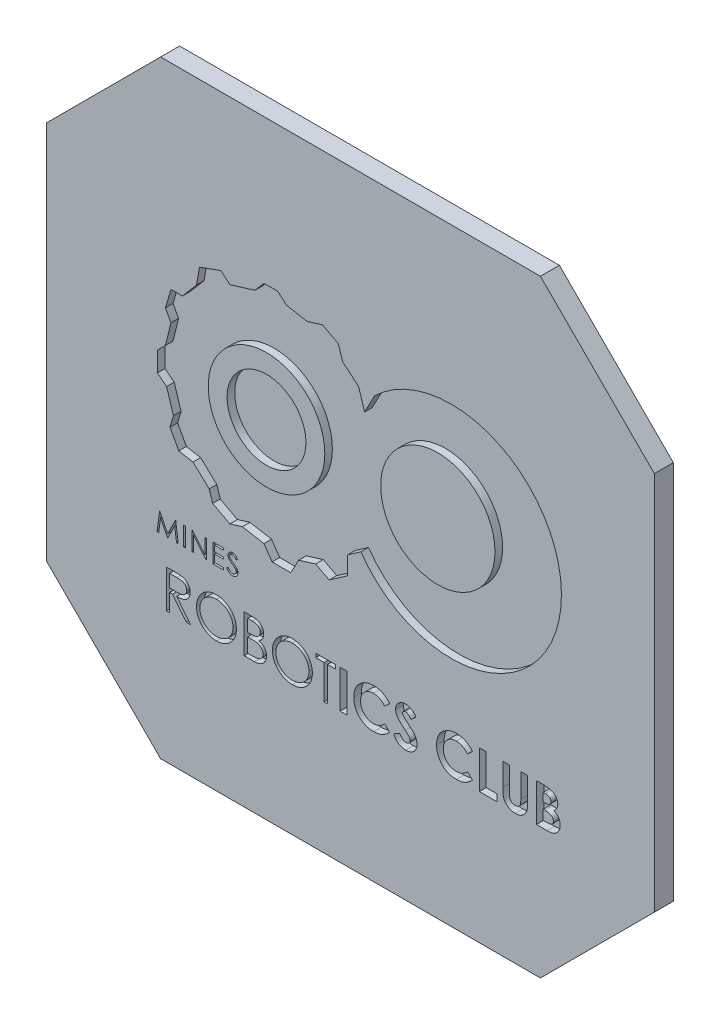
from build123d import *

# Parameters (mm, degrees)
BOSS_EXTRUDE1_DEPTH = 5
SKETCH4_W           = 1.794871795
SKETCH4_H           = 10
SKETCH4_W_2         = 0.448717949
SKETCH4_H_2         = 5
CUT_EXTRUDE1_DEPTH  = 2
SKETCH5_R           = 15.347621391
SKETCH5_R_2         = 10.37860483
SKETCH5_R_3         = 15.052591917
BOSS_EXTRUDE2_DEPTH = 2


with BuildPart() as part:
    # Sketch1 → Boss-Extrude1 (new body)
    with BuildSketch(Plane.XY):
        Polygon((-80, -50), (-50, -80), (50, -80), (80, -50), (80, 50), (50, 80), (-50, 80), (-80, 50), align=None)
    extrude(amount=BOSS_EXTRUDE1_DEPTH)

    # Sketch4 → Cut-Extrude1 (cut)
    # profile 1 of 18: a face of its own
    with BuildSketch(Plane(origin=(0, 0, 5), x_dir=(-1, 0, 0), z_dir=(0, 0, -1))):
        with BuildLine():
            Line((36.304513393, -14.940868697), (31.757487653, -17.348117618))
            Line((31.757487653, -17.348117618), (28.458906023, -16.333169425))
            Line((28.458906023, -16.333169425), (22.797172224, -17.348117618))
            Line((22.797172224, -17.348117618), (20.637668285, -20.450976732))
            Line((20.637668285, -20.450976732), (15.709161512, -20.450976732))
            Line((15.709161512, -20.450976732), (13.651864036, -16.564970389))
            Line((13.651864036, -16.564970389), (9.163595361, -15.183964643))
            Line((9.163595361, -15.183964643), (5.620639841, -17.059646977))
            Line((5.620639841, -17.059646977), (0.741236761, -13.663717678))
            Line((0.741236761, -13.663717678), (0.741236761, -8.881078621))
            Line((0.741236761, -8.881078621), (-2.736472889, -6.460689098))
            ThreePointArc((-2.736472889, -6.460689098), (-55.404131195, 7.310152687), (-6.357286931, 30.930596855))
            Line((-6.357286931, 30.930596855), (-3.693047923, 25.898145394))
            Line((-3.693047923, 25.898145394), (-2.16058621, 30.87864596))
            Line((-2.16058621, 30.87864596), (2.108921504, 34.516755721))
            Line((2.108921504, 34.516755721), (3.180938301, 38.00081031))
            Line((3.180938301, 38.00081031), (7.392117601, 40.230258174))
            Line((7.392117601, 40.230258174), (11.407729698, 38.994685221))
            Line((11.407729698, 38.994685221), (16.778456586, 39.95746619))
            Line((16.778456586, 39.95746619), (19.162521626, 41.988962764))
            Line((19.162521626, 41.988962764), (22.797172224, 41.988962764))
            Line((22.797172224, 41.988962764), (25.146350495, 39.232082018))
            Line((25.146350495, 39.232082018), (31.757487653, 37.197885969))
            Line((31.757487653, 37.197885969), (34.144720665, 39.232082018))
            Line((34.144720665, 39.232082018), (39.760941009, 37.197885969))
            Line((39.760941009, 37.197885969), (40.567664697, 32.69770084))
            Line((40.567664697, 32.69770084), (44.239686443, 28.388395677))
            Line((44.239686443, 28.388395677), (47.270869589, 28.388395677))
            Line((47.270869589, 28.388395677), (48.727775159, 23.441377989))
            Line((48.727775159, 23.441377989), (47.270869589, 20.768136801))
            Line((47.270869589, 20.768136801), (48.727775159, 14.833654176))
            Line((48.727775159, 14.833654176), (50.838106296, 12.73673525))
            Line((50.838106296, 12.73673525), (50.838106296, 7.537525309))
            Line((50.838106296, 7.537525309), (48.425213285, 5.6416808))
            Line((48.425213285, 5.6416808), (46.615543527, -0.10330256))
            Line((46.615543527, -0.10330256), (47.520378406, -3.175728284))
            Line((47.520378406, -3.175728284), (45.207332751, -7.41988044))
            Line((45.207332751, -7.41988044), (41.47378342, -8.08882943))
            Line((41.47378342, -8.08882943), (37.193770816, -12.081592865))
            Line((37.193770816, -12.081592865), (36.304513393, -14.940868697))
        make_face()
    # profile 2 of 18: a face of its own
    with BuildSketch(Plane(origin=(0, 0, 5), x_dir=(-1, 0, 0), z_dir=(0, 0, -1))):
        with BuildLine():
            Line((48.501926314, -35.520202089), (46.50072439, -35.520202089))
            add(Edge.make_bspline(
                [(46.50072439, -35.520202089), (46.367178309, -35.52064662), (46.110755039, -35.52150017), (45.743402838, -35.526259492), (45.409611133, -35.539900509), (45.109554449, -35.551639319), (44.843238292, -35.573044865), (44.609846032, -35.593503857), (44.410452611, -35.620285745), (44.289750179, -35.645158382), (44.23509939, -35.656420037)],
                knots=[0, 0, 0, 0, 1.410062039, 2.707475311, 3.878576406, 4.937260626, 5.877586885, 6.699081471, 7.410979367, 8, 8, 8, 8], degree=3))
            add(Edge.make_bspline(
                [(44.23509939, -35.656420037), (44.161937607, -35.67449651), (44.01717478, -35.710263835), (43.80874602, -35.785862694), (43.610133666, -35.873347336), (43.422162739, -35.976100823), (43.245774764, -36.094885907), (43.079151019, -36.227651971), (42.92153541, -36.373672559), (42.779302181, -36.536629249), (42.645190604, -36.707590706), (42.532080243, -36.892458582), (42.434576015, -37.085777232), (42.356945967, -37.289512712), (42.294437471, -37.501689203), (42.250362501, -37.724228622), (42.223930537, -37.956117122), (42.221239521, -38.114282576), (42.219875031, -38.194480935)],
                knots=[0, 0, 0, 0, 1.027469482, 2.033020251, 3.019912614, 3.986113645, 4.951240523, 5.91722682, 6.890402269, 7.87763091, 8.8651537, 9.85103654, 10.82876324, 11.815024772, 12.821070561, 13.842952187, 14.906261191, 16, 16, 16, 16], degree=3))
            add(Edge.make_bspline(
                [(42.219875031, -38.194480935), (42.224072169, -38.327724091), (42.232261871, -38.587715999), (42.30861931, -38.965032803), (42.433695081, -39.317002274), (42.606047335, -39.643181239), (42.825531552, -39.937211654), (43.089316669, -40.195470098), (43.397549845, -40.411584134), (43.684490747, -40.56144929), (43.937959889, -40.657429029), (44.146626497, -40.724961483), (44.374246433, -40.777138527), (44.618638818, -40.82388176), (44.88082069, -40.859172316), (45.16016366, -40.885019729), (45.456866951, -40.901174154), (45.660692863, -40.903579882), (45.765548108, -40.904817473)],
                knots=[0, 0, 0, 0, 1.260483769, 2.459530307, 3.627416485, 4.787058657, 5.939039949, 7.08810263, 8.267026773, 9.491475466, 10.141966685, 10.831826277, 11.566392101, 12.351337768, 13.187381173, 14.07005841, 15.007169909, 16, 16, 16, 16], degree=3))
            Line((45.765548108, -40.904817473), (42.091669903, -45.520202089))
            Line((42.091669903, -45.520202089), (43.201445544, -45.520202089))
            Line((43.201445544, -45.520202089), (46.875323749, -40.904817473))
            Line((46.875323749, -40.904817473), (47.604490416, -40.904817473))
            Line((47.604490416, -40.904817473), (47.604490416, -45.520202089))
            Line((47.604490416, -45.520202089), (48.501926314, -45.520202089))
            Line((48.501926314, -45.520202089), (48.501926314, -35.520202089))
        make_face()
        with BuildLine():
            Line((47.604490416, -36.545843114), (47.604490416, -39.879176448))
            Line((47.604490416, -39.879176448), (45.773560929, -39.893198884))
            add(Edge.make_bspline(
                [(45.773560929, -39.893198884), (45.688075103, -39.893236703), (45.522379226, -39.893310007), (45.282663041, -39.881899217), (45.059462722, -39.868918308), (44.853632001, -39.849063035), (44.665078929, -39.823474259), (44.493897748, -39.791465732), (44.339809028, -39.754174125), (44.160098919, -39.696455194), (43.959423115, -39.605009427), (43.741333229, -39.471965146), (43.555612264, -39.304624805), (43.398704086, -39.113272074), (43.272619997, -38.902882791), (43.183728413, -38.675978879), (43.127321435, -38.438288599), (43.120668448, -38.274922577), (43.117310929, -38.19247773)],
                knots=[0, 0, 0, 0, 1.146690395, 2.22261258, 3.21895312, 4.145990853, 4.996080663, 5.770904154, 6.481378293, 7.121626537, 8.300444488, 9.431385265, 10.535395872, 11.636531494, 12.74115979, 13.810798291, 14.895190096, 16, 16, 16, 16], degree=3))
            add(Edge.make_bspline(
                [(43.117310929, -38.19247773), (43.120745561, -38.112058948), (43.127551747, -37.952698266), (43.183119657, -37.719395665), (43.277089318, -37.499204379), (43.403724284, -37.293020136), (43.558007584, -37.105860891), (43.73891562, -36.945726168), (43.941501892, -36.81358484), (44.130848173, -36.729143753), (44.30008878, -36.677372744), (44.447030666, -36.640940847), (44.613063459, -36.611670936), (44.798993341, -36.588219333), (45.004026572, -36.56806235), (45.229199861, -36.554485839), (45.473019233, -36.546446228), (45.642010465, -36.546048831), (45.729490416, -36.545843114)],
                knots=[0, 0, 0, 0, 1.101028733, 2.181837193, 3.264309656, 4.369019818, 5.486613113, 6.575447106, 7.666700264, 8.788928104, 9.402425223, 10.0903467, 10.862060571, 11.710948788, 12.657782767, 13.684531032, 14.801375019, 16, 16, 16, 16], degree=3))
            Line((45.729490416, -36.545843114), (47.604490416, -36.545843114))
        make_face(mode=Mode.SUBTRACT)
    # profile 3 of 18: a face of its own
    with BuildSketch(Plane(origin=(0, 0, 5), x_dir=(-1, 0, 0), z_dir=(0, 0, -1))):
        with BuildLine():
            add(Edge.make_bspline(
                [(35.360900673, -35.263791832), (35.175734656, -35.268481773), (34.812053321, -35.277693205), (34.277553614, -35.348204929), (33.767281913, -35.470191758), (33.277081516, -35.632657422), (32.812815869, -35.849384237), (32.370990462, -36.111341804), (31.952656537, -36.421274543), (31.563452589, -36.77678662), (31.207289874, -37.163596488), (30.893501628, -37.576390517), (30.630523646, -38.012672809), (30.414564254, -38.471132325), (30.245139655, -38.950732234), (30.128228101, -39.454029385), (30.053547672, -39.977762785), (30.04481688, -40.334982398), (30.040387852, -40.516195679)],
                knots=[0, 0, 0, 0, 1.065120563, 2.091984664, 3.0946048, 4.079830382, 5.057816894, 6.036188127, 7.030412546, 8.04752943, 9.064399622, 10.05169764, 11.02544977, 11.989514704, 12.962713494, 13.945757189, 14.957906945, 16, 16, 16, 16], degree=3))
            add(Edge.make_bspline(
                [(30.040387852, -40.516195679), (30.044816231, -40.696074097), (30.053545078, -41.050635298), (30.128313014, -41.571045138), (30.245573014, -42.071304271), (30.412990917, -42.550577565), (30.627920856, -43.009370604), (30.892649916, -43.446476187), (31.204481947, -43.862037611), (31.559358664, -44.251502368), (31.946218784, -44.608637999), (32.361162403, -44.919834787), (32.794857603, -45.187618), (33.252885341, -45.40128564), (33.72917116, -45.572062555), (34.227977798, -45.688498641), (34.746967952, -45.763604479), (35.100885106, -45.77222881), (35.280772467, -45.776612345)],
                knots=[0, 0, 0, 0, 1.043624062, 2.057103931, 3.04512605, 4.022047818, 4.998200453, 5.980619268, 6.982898556, 8.009068085, 9.034988726, 10.034168286, 11.015286542, 11.987931943, 12.962482838, 13.94673481, 14.956375938, 16, 16, 16, 16], degree=3))
            add(Edge.make_bspline(
                [(35.280772467, -45.776612345), (35.461984807, -45.772185526), (35.819202567, -45.763459086), (36.343594097, -45.688655072), (36.847244794, -45.571679918), (37.328714368, -45.404510101), (37.78827131, -45.18846087), (38.226814404, -44.925019787), (38.642583396, -44.612427955), (39.032131243, -44.257666313), (39.388557523, -43.871461879), (39.699298597, -43.457649722), (39.96279892, -43.024348417), (40.178122728, -42.570355491), (40.348592611, -42.097865655), (40.464892092, -41.603727147), (40.540137669, -41.090757131), (40.548808659, -40.741491707), (40.553208365, -40.564272602)],
                knots=[0, 0, 0, 0, 1.053102029, 2.075944431, 3.073151272, 4.055350789, 5.033113405, 6.020478099, 7.024410459, 8.052272461, 9.079885166, 10.07527673, 11.055994387, 12.023226415, 12.992069828, 13.970394897, 14.97016774, 16, 16, 16, 16], degree=3))
            add(Edge.make_bspline(
                [(40.553208365, -40.564272602), (40.551680835, -40.445322118), (40.548645045, -40.208921765), (40.512097352, -39.857874336), (40.45906392, -39.512472457), (40.383058456, -39.17369832), (40.283653693, -38.842381221), (40.166362186, -38.516236184), (40.023105485, -38.198568402), (39.861160777, -37.887872997), (39.680412754, -37.588993266), (39.480767755, -37.306480172), (39.269238131, -37.037963038), (39.037342721, -36.79040017), (38.792724306, -36.556589723), (38.531414654, -36.340124817), (38.255008242, -36.139053529), (37.962315728, -35.957852554), (37.660549228, -35.793969312), (37.34947272, -35.653335453), (37.033311088, -35.53263242), (36.710583522, -35.43480149), (36.38214703, -35.357567102), (36.047284789, -35.304974663), (35.706263571, -35.268333755), (35.476516945, -35.26531232), (35.360900673, -35.263791832)],
                knots=[0, 0, 0, 0, 1.037015668, 2.060948919, 3.074880161, 4.083647147, 5.086022904, 6.090072063, 7.104153813, 8.122640571, 9.144368836, 10.147691507, 11.138137339, 12.123020368, 13.103399296, 14.087645067, 15.080126199, 16.082011238, 17.087798457, 18.072939717, 19.057185487, 20.037253025, 21.01195951, 21.997135196, 22.992090687, 24, 24, 24, 24], degree=3))
        make_face()
        with BuildLine():
            add(Edge.make_bspline(
                [(35.31683016, -36.289432858), (35.411729113, -36.290589687), (35.600619778, -36.292892287), (35.881432739, -36.323222902), (36.15855255, -36.366451157), (36.432036442, -36.428112645), (36.700740126, -36.512124224), (36.967168243, -36.608812533), (37.228891254, -36.726587078), (37.485045134, -36.859651947), (37.73337392, -37.006934578), (37.967695924, -37.169711055), (38.188617764, -37.344164067), (38.395598526, -37.530700746), (38.588030447, -37.730271036), (38.769701022, -37.939849425), (38.933328398, -38.165426257), (39.083287189, -38.400884562), (39.217481019, -38.645917651), (39.336810603, -38.897945829), (39.434422057, -39.159024934), (39.514028847, -39.426322528), (39.580028306, -39.699415269), (39.621839518, -39.980374838), (39.652503402, -40.267789443), (39.654674389, -40.462023312), (39.655772467, -40.560266191)],
                knots=[0, 0, 0, 0, 1.008559885, 2.007477868, 2.99961109, 3.989939068, 4.984837346, 5.991145699, 7.001802488, 8.033829008, 9.059044045, 10.069351652, 11.065060232, 12.050310815, 13.029377138, 14.011219647, 14.996725999, 15.989392538, 16.977580475, 17.965360261, 18.951710183, 19.937753436, 20.929683414, 21.935841486, 22.955955122, 24, 24, 24, 24], degree=3))
            add(Edge.make_bspline(
                [(39.655772467, -40.560266191), (39.652130005, -40.704729679), (39.644964154, -40.988934052), (39.582228239, -41.405414463), (39.485594026, -41.805666709), (39.343144408, -42.187500736), (39.164999795, -42.554198687), (38.944922965, -42.902507557), (38.684182721, -43.232521484), (38.388001216, -43.541936538), (38.064222054, -43.824353122), (37.720414255, -44.072248575), (37.36026109, -44.281992146), (36.982823368, -44.452863781), (36.590116114, -44.588263032), (36.179608825, -44.681059121), (35.754036084, -44.742131851), (35.463948497, -44.747996868), (35.31683016, -44.75097132)],
                knots=[0, 0, 0, 0, 1.032063989, 2.030389145, 3.003944642, 3.970395727, 4.937377036, 5.913328081, 6.909231446, 7.93887556, 8.970685674, 9.976071282, 10.964166581, 11.944589148, 12.933237628, 13.927779006, 14.949070134, 16, 16, 16, 16], degree=3))
            add(Edge.make_bspline(
                [(35.31683016, -44.75097132), (35.217945869, -44.749612736), (35.021828623, -44.746918256), (34.73012713, -44.719779179), (34.443680811, -44.676259552), (34.16289144, -44.613600536), (33.888077693, -44.535179946), (33.618092541, -44.442015009), (33.355811712, -44.325782999), (33.097926461, -44.19736028), (32.851080056, -44.05095983), (32.615435678, -43.893707974), (32.396932879, -43.719511915), (32.19010696, -43.535746736), (31.996884992, -43.338707171), (31.818573608, -43.128649394), (31.655773231, -42.904247516), (31.505871383, -42.669146357), (31.372147775, -42.423442778), (31.255636064, -42.170500841), (31.156790018, -41.910943385), (31.07699429, -41.644396038), (31.0144644, -41.371365042), (30.971378914, -41.091484818), (30.941240518, -40.805315268), (30.938968869, -40.611761394), (30.937823749, -40.514192473)],
                knots=[0, 0, 0, 0, 1.047197238, 2.076906641, 3.100256066, 4.114471768, 5.12198147, 6.126382909, 7.136867548, 8.15857795, 9.17633901, 10.174870724, 11.156907918, 12.133735059, 13.104061851, 14.077631395, 15.04955518, 16.038496417, 17.029181396, 18.010275684, 18.986308667, 19.968651475, 20.955262928, 21.950658345, 22.966943676, 24, 24, 24, 24], degree=3))
            add(Edge.make_bspline(
                [(30.937823749, -40.514192473), (30.938969787, -40.417291033), (30.941243162, -40.225069175), (30.971364518, -39.940895408), (31.014509919, -39.66302909), (31.076689085, -39.392561081), (31.156832382, -39.129422438), (31.255653325, -38.873860302), (31.372182753, -38.624922602), (31.505920537, -38.38322461), (31.656251461, -38.151296787), (31.820520727, -37.929575609), (32.001564579, -37.722224919), (32.194210365, -37.524125793), (32.403270037, -37.339503252), (32.627796591, -37.16829605), (32.865064242, -37.006372409), (33.116284915, -36.860299375), (33.375553354, -36.725401567), (33.641593234, -36.609827273), (33.911390661, -36.511621217), (34.184259554, -36.42785846), (34.462496635, -36.36669266), (34.74422186, -36.323183946), (35.029045456, -36.292902843), (35.220597512, -36.29059319), (35.31683016, -36.289432858)],
                knots=[0, 0, 0, 0, 1.02996197, 2.043119294, 3.035359645, 4.018872909, 4.991431989, 5.957985074, 6.929999688, 7.912076566, 8.892894881, 9.867085534, 10.843653904, 11.817741046, 12.803660682, 13.806313499, 14.818574707, 15.856120519, 16.894564902, 17.924820532, 18.937903209, 19.946497019, 20.957711757, 21.963978472, 22.977135795, 24, 24, 24, 24], degree=3))
        make_face(mode=Mode.SUBTRACT)
    # profile 4 of 18: a face of its own
    with BuildSketch(Plane(origin=(0, 0, 5), x_dir=(-1, 0, 0), z_dir=(0, 0, -1))):
        with BuildLine():
            Line((27.989105801, -35.520202089), (26.037984006, -35.520202089))
            add(Edge.make_bspline(
                [(26.037984006, -35.520202089), (25.942474068, -35.520704233), (25.757352039, -35.521677513), (25.488153633, -35.536772173), (25.236014174, -35.557354087), (25.000860539, -35.590011495), (24.782801389, -35.629416572), (24.581179569, -35.677136047), (24.396636219, -35.734354943), (24.176314115, -35.825344318), (23.925112227, -35.96055337), (23.653116819, -36.160349271), (23.420533278, -36.404727737), (23.220000943, -36.680392467), (23.060569173, -36.983637529), (22.945228324, -37.307235211), (22.872205823, -37.647011617), (22.864696011, -37.880277839), (22.860900673, -37.998166832)],
                knots=[0, 0, 0, 0, 1.001505555, 1.941167018, 2.826882275, 3.653841531, 4.429895133, 5.150066043, 5.825578002, 6.45369114, 7.647487171, 8.808567382, 9.977351308, 11.170798116, 12.373658725, 13.556498008, 14.765093433, 16, 16, 16, 16], degree=3))
            add(Edge.make_bspline(
                [(22.860900673, -37.998166832), (22.864024154, -38.108602706), (22.870162089, -38.325619611), (22.928855687, -38.643031352), (23.020743311, -38.945177692), (23.148472595, -39.230955936), (23.314478298, -39.493909116), (23.511216351, -39.736158448), (23.748578644, -39.947447182), (23.926416473, -40.065569761), (24.016750031, -40.125570679)],
                knots=[0, 0, 0, 0, 1.044552857, 2.05264487, 3.044412934, 4.028983338, 5.005914585, 5.980388656, 6.974128949, 8, 8, 8, 8], degree=3))
            add(Edge.make_bspline(
                [(24.016750031, -40.125570679), (23.90314881, -40.169184961), (23.685801532, -40.252629888), (23.386698639, -40.400159785), (23.128999082, -40.560622958), (22.910721522, -40.735856815), (22.724042508, -40.924739132), (22.561034103, -41.130039458), (22.421944463, -41.354435909), (22.302764681, -41.595588867), (22.209768235, -41.85103592), (22.140122794, -42.118380995), (22.100215797, -42.396665438), (22.094536822, -42.586052236), (22.091669903, -42.681660422)],
                knots=[0, 0, 0, 0, 1.27268992, 2.434971085, 3.483601985, 4.442670788, 5.356604649, 6.2567628, 7.179492994, 8.113709626, 9.066344395, 10.018646069, 10.999752585, 12, 12, 12, 12], degree=3))
            add(Edge.make_bspline(
                [(22.091669903, -42.681660422), (22.094460892, -42.779280057), (22.09995224, -42.971349423), (22.140466445, -43.25350695), (22.209063894, -43.523149655), (22.303552884, -43.782021605), (22.426873782, -44.029621989), (22.57695368, -44.266231315), (22.755901005, -44.48947226), (22.956080631, -44.701825469), (23.182543904, -44.892762004), (23.426874632, -45.06280688), (23.692149832, -45.202652772), (23.974012672, -45.320127119), (24.275625003, -45.409861972), (24.595632453, -45.472640754), (24.93375903, -45.51494086), (25.16578689, -45.518418588), (25.284778878, -45.520202089)],
                knots=[0, 0, 0, 0, 0.978564426, 1.925352924, 2.850884081, 3.763762016, 4.682927383, 5.618979971, 6.567305752, 7.547517671, 8.540179244, 9.531824382, 10.526200242, 11.540722885, 12.589160233, 13.674978461, 14.80764778, 16, 16, 16, 16], degree=3))
            Line((25.284778878, -45.520202089), (27.989105801, -45.520202089))
            Line((27.989105801, -45.520202089), (27.989105801, -35.520202089))
        make_face()
        with BuildLine():
            Line((27.091669903, -36.545843114), (27.091669903, -39.75097132))
            Line((27.091669903, -39.75097132), (26.48870516, -39.75097132))
            add(Edge.make_bspline(
                [(26.48870516, -39.75097132), (26.400565744, -39.749828682), (26.230262432, -39.747620875), (25.983634156, -39.74129654), (25.754705533, -39.723587845), (25.543871724, -39.705884239), (25.351464741, -39.677099703), (25.177910851, -39.642836494), (25.020486289, -39.606599623), (24.83894473, -39.544972517), (24.63302202, -39.453893445), (24.413498865, -39.312545342), (24.219971809, -39.144190047), (24.056551273, -38.949930156), (23.922804214, -38.736026768), (23.829907885, -38.505892824), (23.766915645, -38.265263875), (23.761225555, -38.100068867), (23.75833657, -38.016195679)],
                knots=[0, 0, 0, 0, 1.156816544, 2.235205308, 3.236616184, 4.169592532, 5.011045266, 5.787822928, 6.49130361, 7.128639758, 8.301311294, 9.436451833, 10.541879658, 11.654887649, 12.756523258, 13.837046038, 14.901820046, 16, 16, 16, 16], degree=3))
            add(Edge.make_bspline(
                [(23.75833657, -38.016195679), (23.759839942, -37.960693474), (23.76278897, -37.85181984), (23.786941263, -37.693107399), (23.827991476, -37.543839535), (23.880718028, -37.401970648), (23.954399996, -37.27193679), (24.041152748, -37.149241946), (24.145969006, -37.038064464), (24.265275614, -36.934151612), (24.402443108, -36.84202439), (24.557389656, -36.761336495), (24.73221159, -36.696362847), (24.923962604, -36.639459554), (25.135594283, -36.599493001), (25.364664436, -36.566197607), (25.613049347, -36.549246916), (25.784892497, -36.547003022), (25.873721185, -36.545843114)],
                knots=[0, 0, 0, 0, 0.91205012, 1.789085906, 2.630437955, 3.453916878, 4.269457761, 5.079663411, 5.91843418, 6.774407191, 7.675494373, 8.627863946, 9.638891023, 10.736472738, 11.911756761, 13.175263542, 14.539845004, 16, 16, 16, 16], degree=3))
            Line((25.873721185, -36.545843114), (27.091669903, -36.545843114))
        make_face(mode=Mode.SUBTRACT)
        with BuildLine():
            Line((27.091669903, -40.776612345), (27.091669903, -44.494561063))
            Line((27.091669903, -44.494561063), (25.813625031, -44.494561063))
            add(Edge.make_bspline(
                [(25.813625031, -44.494561063), (25.722142386, -44.493464642), (25.545821647, -44.491351435), (25.291246704, -44.484452707), (25.055294979, -44.468760491), (24.839043163, -44.444058064), (24.640156155, -44.417262495), (24.461019861, -44.381230263), (24.300182165, -44.339947519), (24.113684143, -44.276135598), (23.903674119, -44.177002824), (23.677357387, -44.027533606), (23.476139621, -43.849467012), (23.305267451, -43.643378686), (23.165230341, -43.419289181), (23.063357612, -43.181731038), (23.000526593, -42.934629531), (22.992920395, -42.766153209), (22.989105801, -42.681660422)],
                knots=[0, 0, 0, 0, 1.160039823, 2.235823828, 3.228722157, 4.157150951, 4.99529583, 5.772374946, 6.472645482, 7.099169577, 8.269452708, 9.405989375, 10.527446681, 11.663510218, 12.788923519, 13.866172445, 14.929861265, 16, 16, 16, 16], degree=3))
            add(Edge.make_bspline(
                [(22.989105801, -42.681660422), (22.98989467, -42.628822306), (22.991459685, -42.523998358), (23.015061442, -42.369953161), (23.049386784, -42.22073638), (23.093762309, -42.075942836), (23.158389358, -41.938190332), (23.23383663, -41.804754447), (23.322297777, -41.675458792), (23.460138251, -41.511995211), (23.660629635, -41.323660888), (23.945506137, -41.139268024), (24.269426988, -40.990560004), (24.504362682, -40.927418643), (24.62572439, -40.894801448)],
                knots=[0, 0, 0, 0, 0.723448775, 1.435228256, 2.130040452, 2.821711965, 3.505591119, 4.210454504, 4.921174351, 5.648778258, 7.137944449, 8.670945889, 10.280296675, 12, 12, 12, 12], degree=3))
            add(Edge.make_bspline(
                [(24.62572439, -40.894801448), (24.67437895, -40.884929779), (24.779872071, -40.863525966), (24.951893729, -40.840932528), (25.148281926, -40.820803785), (25.369490147, -40.805914763), (25.615798264, -40.790524639), (25.887732318, -40.784539436), (26.184181788, -40.777398692), (26.389874281, -40.776881166), (26.49671798, -40.776612345)],
                knots=[0, 0, 0, 0, 0.634451884, 1.375622551, 2.216452059, 3.157844607, 4.20941857, 5.370758133, 6.634282058, 8, 8, 8, 8], degree=3))
            Line((26.49671798, -40.776612345), (27.091669903, -40.776612345))
        make_face(mode=Mode.SUBTRACT)
    # profile 5 of 18: a face of its own
    with BuildSketch(Plane(origin=(0, 0, 5), x_dir=(-1, 0, 0), z_dir=(0, 0, -1))):
        with BuildLine():
            add(Edge.make_bspline(
                [(15.360900673, -35.263791832), (15.175734656, -35.268481773), (14.812053321, -35.277693205), (14.277553614, -35.348204929), (13.767281913, -35.470191758), (13.277081516, -35.632657422), (12.812815869, -35.849384237), (12.370990462, -36.111341804), (11.952656537, -36.421274543), (11.563452589, -36.77678662), (11.207289874, -37.163596488), (10.893501628, -37.576390517), (10.630523646, -38.012672809), (10.414564254, -38.471132325), (10.245139655, -38.950732234), (10.128228101, -39.454029385), (10.053547672, -39.977762785), (10.04481688, -40.334982398), (10.040387852, -40.516195679)],
                knots=[0, 0, 0, 0, 1.065120563, 2.091984664, 3.0946048, 4.079830382, 5.057816894, 6.036188127, 7.030412546, 8.04752943, 9.064399622, 10.05169764, 11.02544977, 11.989514704, 12.962713494, 13.945757189, 14.957906945, 16, 16, 16, 16], degree=3))
            add(Edge.make_bspline(
                [(10.040387852, -40.516195679), (10.044816231, -40.696074097), (10.053545078, -41.050635298), (10.128313014, -41.571045138), (10.245573014, -42.071304271), (10.412990917, -42.550577565), (10.627920856, -43.009370604), (10.892649916, -43.446476187), (11.204481947, -43.862037611), (11.559358664, -44.251502368), (11.946218784, -44.608637999), (12.361162403, -44.919834787), (12.794857603, -45.187618), (13.252885341, -45.40128564), (13.72917116, -45.572062555), (14.227977798, -45.688498641), (14.746967952, -45.763604479), (15.100885106, -45.77222881), (15.280772467, -45.776612345)],
                knots=[0, 0, 0, 0, 1.043624062, 2.057103931, 3.04512605, 4.022047818, 4.998200453, 5.980619268, 6.982898556, 8.009068085, 9.034988726, 10.034168286, 11.015286542, 11.987931943, 12.962482838, 13.94673481, 14.956375938, 16, 16, 16, 16], degree=3))
            add(Edge.make_bspline(
                [(15.280772467, -45.776612345), (15.461984807, -45.772185526), (15.819202567, -45.763459086), (16.343594097, -45.688655072), (16.847244794, -45.571679918), (17.328714368, -45.404510101), (17.78827131, -45.18846087), (18.226814404, -44.925019787), (18.642583396, -44.612427955), (19.032131243, -44.257666313), (19.388557523, -43.871461879), (19.699298597, -43.457649722), (19.96279892, -43.024348417), (20.178122728, -42.570355491), (20.348592611, -42.097865655), (20.464892092, -41.603727147), (20.540137669, -41.090757131), (20.548808659, -40.741491707), (20.553208365, -40.564272602)],
                knots=[0, 0, 0, 0, 1.053102029, 2.075944431, 3.073151272, 4.055350789, 5.033113405, 6.020478099, 7.024410459, 8.052272461, 9.079885166, 10.07527673, 11.055994387, 12.023226415, 12.992069828, 13.970394897, 14.97016774, 16, 16, 16, 16], degree=3))
            add(Edge.make_bspline(
                [(20.553208365, -40.564272602), (20.551680835, -40.445322118), (20.548645045, -40.208921765), (20.512097352, -39.857874336), (20.45906392, -39.512472457), (20.383058456, -39.17369832), (20.283653693, -38.842381221), (20.166362186, -38.516236184), (20.023105485, -38.198568402), (19.861160777, -37.887872997), (19.680412754, -37.588993266), (19.480767755, -37.306480172), (19.269238131, -37.037963038), (19.037342721, -36.79040017), (18.792724306, -36.556589723), (18.531414654, -36.340124817), (18.255008242, -36.139053529), (17.962315728, -35.957852554), (17.660549228, -35.793969312), (17.34947272, -35.653335453), (17.033311088, -35.53263242), (16.710583522, -35.43480149), (16.38214703, -35.357567102), (16.047284789, -35.304974663), (15.706263571, -35.268333755), (15.476516945, -35.26531232), (15.360900673, -35.263791832)],
                knots=[0, 0, 0, 0, 1.037015668, 2.060948919, 3.074880161, 4.083647147, 5.086022904, 6.090072063, 7.104153813, 8.122640571, 9.144368836, 10.147691507, 11.138137339, 12.123020368, 13.103399296, 14.087645067, 15.080126199, 16.082011238, 17.087798457, 18.072939717, 19.057185487, 20.037253025, 21.01195951, 21.997135196, 22.992090687, 24, 24, 24, 24], degree=3))
        make_face()
        with BuildLine():
            add(Edge.make_bspline(
                [(15.31683016, -36.289432858), (15.411729113, -36.290589687), (15.600619778, -36.292892287), (15.881432739, -36.323222902), (16.15855255, -36.366451157), (16.432036442, -36.428112645), (16.700740126, -36.512124224), (16.967168243, -36.608812533), (17.228891254, -36.726587078), (17.485045134, -36.859651947), (17.73337392, -37.006934578), (17.967695924, -37.169711055), (18.188617764, -37.344164067), (18.395598526, -37.530700746), (18.588030447, -37.730271036), (18.769701022, -37.939849425), (18.933328398, -38.165426257), (19.083287189, -38.400884562), (19.217481019, -38.645917651), (19.336810603, -38.897945829), (19.434422057, -39.159024934), (19.514028847, -39.426322528), (19.580028306, -39.699415269), (19.621839518, -39.980374838), (19.652503402, -40.267789443), (19.654674389, -40.462023312), (19.655772467, -40.560266191)],
                knots=[0, 0, 0, 0, 1.008559885, 2.007477868, 2.99961109, 3.989939068, 4.984837346, 5.991145699, 7.001802488, 8.033829008, 9.059044045, 10.069351652, 11.065060232, 12.050310815, 13.029377138, 14.011219647, 14.996725999, 15.989392538, 16.977580475, 17.965360261, 18.951710183, 19.937753436, 20.929683414, 21.935841486, 22.955955122, 24, 24, 24, 24], degree=3))
            add(Edge.make_bspline(
                [(19.655772467, -40.560266191), (19.652130005, -40.704729679), (19.644964154, -40.988934052), (19.582228239, -41.405414463), (19.485594026, -41.805666709), (19.343144408, -42.187500736), (19.164999795, -42.554198687), (18.944922965, -42.902507557), (18.684182721, -43.232521484), (18.388001216, -43.541936538), (18.064222054, -43.824353122), (17.720414255, -44.072248575), (17.36026109, -44.281992146), (16.982823368, -44.452863781), (16.590116114, -44.588263032), (16.179608825, -44.681059121), (15.754036084, -44.742131851), (15.463948497, -44.747996868), (15.31683016, -44.75097132)],
                knots=[0, 0, 0, 0, 1.032063989, 2.030389145, 3.003944642, 3.970395727, 4.937377036, 5.913328081, 6.909231446, 7.93887556, 8.970685674, 9.976071282, 10.964166581, 11.944589148, 12.933237628, 13.927779006, 14.949070134, 16, 16, 16, 16], degree=3))
            add(Edge.make_bspline(
                [(15.31683016, -44.75097132), (15.217945869, -44.749612736), (15.021828623, -44.746918256), (14.73012713, -44.719779179), (14.443680811, -44.676259552), (14.16289144, -44.613600536), (13.888077693, -44.535179946), (13.618092541, -44.442015009), (13.355811712, -44.325782999), (13.097926461, -44.19736028), (12.851080056, -44.05095983), (12.615435678, -43.893707974), (12.396932879, -43.719511915), (12.19010696, -43.535746736), (11.996884992, -43.338707171), (11.818573608, -43.128649394), (11.655773231, -42.904247516), (11.505871383, -42.669146357), (11.372147775, -42.423442778), (11.255636064, -42.170500841), (11.156790018, -41.910943385), (11.07699429, -41.644396038), (11.0144644, -41.371365042), (10.971378914, -41.091484818), (10.941240518, -40.805315268), (10.938968869, -40.611761394), (10.937823749, -40.514192473)],
                knots=[0, 0, 0, 0, 1.047197238, 2.076906641, 3.100256066, 4.114471768, 5.12198147, 6.126382909, 7.136867548, 8.15857795, 9.17633901, 10.174870724, 11.156907918, 12.133735059, 13.104061851, 14.077631395, 15.04955518, 16.038496417, 17.029181396, 18.010275684, 18.986308667, 19.968651475, 20.955262928, 21.950658345, 22.966943676, 24, 24, 24, 24], degree=3))
            add(Edge.make_bspline(
                [(10.937823749, -40.514192473), (10.938969787, -40.417291033), (10.941243162, -40.225069175), (10.971364518, -39.940895408), (11.014509919, -39.66302909), (11.076689085, -39.392561081), (11.156832382, -39.129422438), (11.255653325, -38.873860302), (11.372182753, -38.624922602), (11.505920537, -38.38322461), (11.656251461, -38.151296787), (11.820520727, -37.929575609), (12.001564579, -37.722224919), (12.194210365, -37.524125793), (12.403270037, -37.339503252), (12.627796591, -37.16829605), (12.865064242, -37.006372409), (13.116284915, -36.860299375), (13.375553354, -36.725401567), (13.641593234, -36.609827273), (13.911390661, -36.511621217), (14.184259554, -36.42785846), (14.462496635, -36.36669266), (14.74422186, -36.323183946), (15.029045456, -36.292902843), (15.220597512, -36.29059319), (15.31683016, -36.289432858)],
                knots=[0, 0, 0, 0, 1.02996197, 2.043119294, 3.035359645, 4.018872909, 4.991431989, 5.957985074, 6.929999688, 7.912076566, 8.892894881, 9.867085534, 10.843653904, 11.817741046, 12.803660682, 13.806313499, 14.818574707, 15.856120519, 16.894564902, 17.924820532, 18.937903209, 19.946497019, 20.957711757, 21.963978472, 22.977135795, 24, 24, 24, 24], degree=3))
        make_face(mode=Mode.SUBTRACT)
    # profile 6 of 18: a face of its own
    with BuildSketch(Plane(origin=(0, 0, 5), x_dir=(-1, 0, 0), z_dir=(0, 0, -1))):
        Polygon((9.142951955, -36.545843114), (9.142951955, -35.520202089), (3.886541698, -35.520202089), (3.886541698, -36.545843114), (6.066028878, -36.545843114), (6.066028878, -45.520202089), (6.963464775, -45.520202089), (6.963464775, -36.545843114), align=None)
    # profile 7 of 18: a face of its own
    with BuildSketch(Plane(origin=(0, 0, 5), x_dir=(-1, 0, 0), z_dir=(0, 0, -1))):
        with Locations((1.835259647, -40.520202089)):
            Rectangle(SKETCH4_W, SKETCH4_H)
    # profile 8 of 18: a face of its own
    with BuildSketch(Plane(origin=(0, 0, 5), x_dir=(-1, 0, 0), z_dir=(0, 0, -1))):
        with BuildLine():
            Line((-10.344227533, -37.25497773), (-9.028121763, -38.51299055))
            add(Edge.make_bspline(
                [(-9.028121763, -38.51299055), (-8.91647895, -38.397551694), (-8.698405559, -38.172063442), (-8.347007259, -37.873536868), (-7.981565822, -37.624755361), (-7.609190181, -37.415233159), (-7.223182377, -37.256714681), (-6.828005714, -37.141199596), (-6.42113687, -37.070774415), (-6.145783686, -37.062716528), (-6.00728843, -37.058663627)],
                knots=[0, 0, 0, 0, 1.115251505, 2.178435587, 3.19620269, 4.182487026, 5.141301733, 6.088180966, 7.038406374, 8, 8, 8, 8], degree=3))
            add(Edge.make_bspline(
                [(-6.00728843, -37.058663627), (-5.891628061, -37.061865561), (-5.663385065, -37.068184223), (-5.328264537, -37.114506252), (-5.007704432, -37.193278878), (-4.700607423, -37.301842149), (-4.407877155, -37.442317259), (-4.128899884, -37.614595485), (-3.864363416, -37.817120909), (-3.617762125, -38.048845655), (-3.39217993, -38.302022353), (-3.192863697, -38.572161286), (-3.02590438, -38.858643581), (-2.888883584, -39.158567956), (-2.782149681, -39.473322608), (-2.705928264, -39.802695633), (-2.661843834, -40.147079289), (-2.655263937, -40.381188732), (-2.65191984, -40.500170037)],
                knots=[0, 0, 0, 0, 1.035432265, 2.043311493, 3.022114605, 3.98653278, 4.95457646, 5.923598177, 6.917315552, 7.932509744, 8.948865224, 9.949768934, 10.933144597, 11.912367597, 12.897413939, 13.903909035, 14.934704909, 16, 16, 16, 16], degree=3))
            add(Edge.make_bspline(
                [(-2.65191984, -40.500170037), (-2.652883571, -40.583679443), (-2.654783104, -40.748278196), (-2.67557685, -40.991765436), (-2.709059686, -41.228005621), (-2.757517644, -41.456640912), (-2.818114797, -41.677869444), (-2.889209055, -41.893599747), (-2.978395757, -42.100850912), (-3.077394341, -42.302030027), (-3.192528553, -42.491647669), (-3.316664474, -42.672463828), (-3.451269612, -42.84359216), (-3.597215814, -43.004333088), (-3.756557091, -43.152174591), (-3.92517506, -43.291562439), (-4.105914072, -43.419007283), (-4.295019722, -43.53770749), (-4.494125642, -43.64082337), (-4.697829627, -43.734226435), (-4.90922024, -43.810083612), (-5.125723674, -43.871231417), (-5.346566222, -43.923228492), (-5.573907928, -43.955244689), (-5.805778025, -43.979490181), (-5.962483292, -43.980987198), (-6.041342917, -43.98174055)],
                knots=[0, 0, 0, 0, 1.103660481, 2.175337485, 3.227646561, 4.255952547, 5.262355991, 6.258840057, 7.255597736, 8.242457506, 9.22035537, 10.185017736, 11.140346927, 12.096287581, 13.051739095, 14.01125915, 14.986044842, 15.97314143, 16.960198552, 17.947847494, 18.933482797, 19.925264591, 20.920966487, 21.929612487, 22.958107872, 24, 24, 24, 24], degree=3))
            add(Edge.make_bspline(
                [(-6.041342917, -43.98174055), (-6.175102394, -43.977871516), (-6.437904984, -43.970269871), (-6.823605571, -43.910826079), (-7.191139806, -43.813044406), (-7.484797901, -43.697569932), (-7.714871262, -43.58353739), (-7.89002271, -43.478062904), (-8.071142959, -43.36007811), (-8.255223756, -43.225130136), (-8.444335645, -43.074838411), (-8.635140365, -42.905911265), (-8.83252255, -42.723911227), (-8.961825663, -42.594014225), (-9.028121763, -42.527413627)],
                knots=[0, 0, 0, 0, 1.404581149, 2.759636711, 4.088442092, 5.392261763, 6.066678138, 6.783632037, 7.538459478, 8.336747902, 9.180226004, 10.074962426, 11.012997595, 12, 12, 12, 12], degree=3))
            Line((-9.028121763, -42.527413627), (-10.30416343, -43.867557858))
            add(Edge.make_bspline(
                [(-10.30416343, -43.867557858), (-10.214464569, -43.954159292), (-10.039391576, -44.123186771), (-9.775298825, -44.363190018), (-9.511538446, -44.578859616), (-9.254482339, -44.778023426), (-8.999919657, -44.954879322), (-8.747877397, -45.109603932), (-8.501208787, -45.246110465), (-8.254791673, -45.362096806), (-8.007092723, -45.460581257), (-7.752239611, -45.545369904), (-7.489453229, -45.617098049), (-7.217128596, -45.674973242), (-6.937805791, -45.721381334), (-6.648870724, -45.752706527), (-6.352155385, -45.773765413), (-6.150888774, -45.775657728), (-6.049355738, -45.776612345)],
                knots=[0, 0, 0, 0, 1.244526981, 2.429050516, 3.560637417, 4.644440555, 5.67424972, 6.652764056, 7.595344123, 8.486817594, 9.369275933, 10.254498637, 11.166417451, 12.086725134, 13.032340136, 13.991389299, 14.986715468, 16, 16, 16, 16], degree=3))
            add(Edge.make_bspline(
                [(-6.049355738, -45.776612345), (-5.862852126, -45.771857996), (-5.497916401, -45.762555057), (-4.963112611, -45.693626574), (-4.455063366, -45.578069188), (-3.972532677, -45.41463917), (-3.515673979, -45.205864981), (-3.08460415, -44.949917629), (-2.680017978, -44.647477125), (-2.305183724, -44.302088366), (-1.966128301, -43.920635477), (-1.666442573, -43.511059722), (-1.418542527, -43.071348186), (-1.212705777, -42.607996814), (-1.051744145, -42.118891153), (-0.938454444, -41.603502139), (-0.868589512, -41.062327413), (-0.86094619, -40.6926926), (-0.857048045, -40.504176448)],
                knots=[0, 0, 0, 0, 1.078019885, 2.10938526, 3.111377082, 4.085535484, 5.04941344, 6.010039228, 6.978205633, 7.964457913, 8.951525778, 9.924444315, 10.892603023, 11.863865945, 12.85144698, 13.863884204, 14.910567087, 16, 16, 16, 16], degree=3))
            add(Edge.make_bspline(
                [(-0.857048045, -40.504176448), (-0.858695212, -40.381227821), (-0.861959494, -40.137573694), (-0.896267401, -39.778651424), (-0.944094618, -39.428766412), (-1.019968149, -39.091551624), (-1.111426207, -38.762464155), (-1.225166318, -38.445080801), (-1.361006824, -38.13848937), (-1.514569265, -37.842176611), (-1.688292919, -37.558083689), (-1.882361311, -37.28865141), (-2.091778365, -37.031799807), (-2.321576031, -36.790936492), (-2.568415048, -36.56394664), (-2.833409866, -36.352060351), (-3.114966673, -36.152238937), (-3.413847539, -35.969635308), (-3.724246006, -35.80446062), (-4.042247131, -35.65876949), (-4.367069623, -35.537005256), (-4.697340103, -35.436006316), (-5.03445396, -35.360617748), (-5.37600496, -35.303551034), (-5.724899292, -35.271650376), (-5.959151611, -35.266428035), (-6.07740061, -35.263791832)],
                knots=[0, 0, 0, 0, 1.071919942, 2.124283339, 3.142214191, 4.149696895, 5.136002878, 6.119640489, 7.086990633, 8.058538607, 9.028339693, 9.988281803, 10.952401235, 11.916291999, 12.888973767, 13.874849856, 14.873389453, 15.898127285, 16.927174885, 17.938320013, 18.946391617, 19.950418109, 20.947802303, 21.956882652, 22.968648068, 24, 24, 24, 24], degree=3))
            add(Edge.make_bspline(
                [(-6.07740061, -35.263791832), (-6.17827913, -35.26530297), (-6.378987316, -35.268309532), (-6.677875484, -35.293372505), (-6.974373285, -35.332733651), (-7.267419165, -35.392121236), (-7.559109288, -35.462621806), (-7.845610519, -35.554932577), (-8.13144257, -35.657830327), (-8.412122589, -35.780823576), (-8.688042365, -35.915081818), (-8.952738042, -36.067402669), (-9.210653836, -36.228412475), (-9.456074489, -36.4076405), (-9.693597257, -36.598585811), (-9.921980113, -36.802139276), (-10.139218864, -37.021694728), (-10.275545842, -37.176823615), (-10.344227533, -37.25497773)],
                knots=[0, 0, 0, 0, 0.996412454, 1.982464992, 2.961075852, 3.949442424, 4.934965278, 5.923860011, 6.921385422, 7.934793307, 8.949617135, 9.951082467, 10.950285876, 11.951772932, 12.951063433, 13.960125323, 14.972308753, 16, 16, 16, 16], degree=3))
        make_face()
    # profile 9 of 18: a face of its own
    with BuildSketch(Plane(origin=(0, 0, 5), x_dir=(-1, 0, 0), z_dir=(0, 0, -1))):
        with BuildLine():
            Line((-17.267304456, -36.856339909), (-15.92515702, -38.084304653))
            add(Edge.make_bspline(
                [(-15.92515702, -38.084304653), (-15.867665179, -38.003206434), (-15.757288861, -37.847509163), (-15.578380363, -37.639026848), (-15.400279729, -37.461175918), (-15.221336964, -37.314699353), (-15.039965987, -37.200487105), (-14.856481634, -37.119623573), (-14.671924127, -37.068217858), (-14.547929971, -37.061816609), (-14.486855738, -37.058663627)],
                knots=[0, 0, 0, 0, 1.299362458, 2.494594718, 3.587462134, 4.587049575, 5.512617175, 6.380583204, 7.202344345, 8, 8, 8, 8], degree=3))
            add(Edge.make_bspline(
                [(-14.486855738, -37.058663627), (-14.429887445, -37.060661501), (-14.319896638, -37.064518871), (-14.163096583, -37.102860839), (-14.023887261, -37.169033446), (-13.902404535, -37.255559696), (-13.806172292, -37.359803768), (-13.729338309, -37.469128995), (-13.68607432, -37.589799322), (-13.680379928, -37.67268057), (-13.677560866, -37.713711704)],
                knots=[0, 0, 0, 0, 1.185010067, 2.2879431, 3.333075148, 4.379039566, 5.372662701, 6.27520591, 7.14612461, 8, 8, 8, 8], degree=3))
            add(Edge.make_bspline(
                [(-13.677560866, -37.713711704), (-13.679327429, -37.755334526), (-13.682885042, -37.839157104), (-13.717246739, -37.962009532), (-13.769039627, -38.082050655), (-13.818529847, -38.155125399), (-13.843826892, -38.19247773)],
                knots=[0, 0, 0, 0, 0.967525499, 1.948461899, 2.951351359, 4, 4, 4, 4], degree=3))
            add(Edge.make_bspline(
                [(-13.843826892, -38.19247773), (-13.866824642, -38.221511306), (-13.919762426, -38.288342764), (-14.020703938, -38.394193376), (-14.147465277, -38.523869641), (-14.304924487, -38.672912372), (-14.486545003, -38.846681728), (-14.700745171, -39.038346771), (-14.941359375, -39.253843144), (-15.112382377, -39.403907014), (-15.201999969, -39.482541832)],
                knots=[0, 0, 0, 0, 0.473873513, 1.090794244, 1.870441696, 2.795289791, 3.865433203, 5.087734844, 6.473946851, 8, 8, 8, 8], degree=3))
            add(Edge.make_bspline(
                [(-15.201999969, -39.482541832), (-15.28611897, -39.555342585), (-15.445759358, -39.693503289), (-15.672895929, -39.889600224), (-15.872511145, -40.066023856), (-16.047512946, -40.220126442), (-16.195248473, -40.353524872), (-16.316338809, -40.466856789), (-16.412262866, -40.557915828), (-16.466790076, -40.612915543), (-16.490060866, -40.636387986)],
                knots=[0, 0, 0, 0, 1.543621617, 2.929473131, 4.163658386, 5.240097082, 6.164993805, 6.925417477, 7.541396219, 8, 8, 8, 8], degree=3))
            add(Edge.make_bspline(
                [(-16.490060866, -40.636387986), (-16.578345393, -40.731930752), (-16.748059258, -40.915597502), (-16.968627455, -41.200223201), (-17.150162215, -41.478075921), (-17.290600949, -41.754383909), (-17.396665928, -42.033133741), (-17.471443144, -42.321161741), (-17.516227716, -42.621477621), (-17.521199849, -42.826406548), (-17.523714712, -42.930057858)],
                knots=[0, 0, 0, 0, 1.206664779, 2.319633467, 3.337109185, 4.282041471, 5.190008762, 6.099243693, 7.03861361, 8, 8, 8, 8], degree=3))
            add(Edge.make_bspline(
                [(-17.523714712, -42.930057858), (-17.521924697, -43.031053348), (-17.518412621, -43.229210258), (-17.475396428, -43.519183379), (-17.414057861, -43.79670024), (-17.319217676, -44.058741067), (-17.20362702, -44.309607179), (-17.058717439, -44.54539088), (-16.888541005, -44.768478398), (-16.693492682, -44.97488177), (-16.477746077, -45.162178523), (-16.246337338, -45.328914517), (-15.997003635, -45.466576318), (-15.731875236, -45.579930992), (-15.451094058, -45.667238277), (-15.154994596, -45.731766498), (-14.843123945, -45.77049532), (-14.6298623, -45.774543958), (-14.520910225, -45.776612345)],
                knots=[0, 0, 0, 0, 1.043214005, 2.046824704, 3.02475056, 3.976699089, 4.921714032, 5.875962561, 6.831408892, 7.817874052, 8.806269674, 9.781291748, 10.760897367, 11.74438705, 12.757449933, 13.795994037, 14.874007457, 16, 16, 16, 16], degree=3))
            add(Edge.make_bspline(
                [(-14.520910225, -45.776612345), (-14.435383774, -45.775095049), (-14.265992352, -45.772089932), (-14.016335005, -45.747555656), (-13.775262614, -45.707959944), (-13.543046726, -45.651207461), (-13.318641168, -45.579294368), (-13.102036722, -45.49145528), (-12.894728682, -45.386328723), (-12.695148456, -45.266076518), (-12.504266252, -45.126447868), (-12.319668438, -44.970297435), (-12.143188615, -44.795223555), (-11.973979186, -44.601640272), (-11.813122802, -44.388999404), (-11.655354053, -44.160262368), (-11.50768466, -43.911184116), (-11.416462707, -43.736453708), (-11.369868558, -43.647205294)],
                knots=[0, 0, 0, 0, 1.016823716, 2.013894106, 2.979844003, 3.91962641, 4.853723003, 5.779685073, 6.695824784, 7.614987388, 8.547259901, 9.504950863, 10.487499108, 11.500346958, 12.559593716, 13.656357062, 14.802919212, 16, 16, 16, 16], degree=3))
            Line((-11.369868558, -43.647205294), (-12.948394199, -42.699689268))
            add(Edge.make_bspline(
                [(-12.948394199, -42.699689268), (-13.006676515, -42.800997879), (-13.118408696, -42.995215145), (-13.307749323, -43.256170656), (-13.501719128, -43.479635856), (-13.704802521, -43.661660981), (-13.914530084, -43.804679944), (-14.131914848, -43.906891216), (-14.357109545, -43.970159878), (-14.510501942, -43.977886443), (-14.587015994, -43.98174055)],
                knots=[0, 0, 0, 0, 1.283663364, 2.460892379, 3.537111102, 4.529833553, 5.449777664, 6.316464042, 7.160231139, 8, 8, 8, 8], degree=3))
            add(Edge.make_bspline(
                [(-14.587015994, -43.98174055), (-14.66484174, -43.978593077), (-14.815835021, -43.972486521), (-15.031358608, -43.9160821), (-15.228958793, -43.827523022), (-15.399762933, -43.70116143), (-15.54438911, -43.555320948), (-15.65113153, -43.393066742), (-15.718187839, -43.217511609), (-15.725277316, -43.095559465), (-15.728842917, -43.034224525)],
                knots=[0, 0, 0, 0, 1.13588714, 2.203786484, 3.234766741, 4.283437687, 5.291419208, 6.222934724, 7.106237994, 8, 8, 8, 8], degree=3))
            add(Edge.make_bspline(
                [(-15.728842917, -43.034224525), (-15.725550231, -42.977162344), (-15.718861453, -42.861245986), (-15.669593979, -42.688897002), (-15.59257389, -42.516626398), (-15.501453694, -42.375325389), (-15.408727484, -42.257017884), (-15.320060314, -42.154509782), (-15.212087155, -42.041256276), (-15.08508178, -41.917114901), (-14.940722263, -41.780992808), (-14.778886998, -41.632903328), (-14.5977228, -41.474150952), (-14.469675588, -41.366010402), (-14.402721122, -41.309464909)],
                knots=[0, 0, 0, 0, 0.916159276, 1.861089862, 2.860218735, 3.940849679, 4.552606315, 5.27541173, 6.11797699, 7.06649574, 8.129236253, 9.306560635, 10.591630461, 12, 12, 12, 12], degree=3))
            add(Edge.make_bspline(
                [(-14.402721122, -41.309464909), (-14.275438018, -41.201771198), (-14.031143216, -40.995074369), (-13.685923666, -40.68978966), (-13.374849941, -40.404473126), (-13.100608808, -40.135597632), (-12.85970601, -39.888128684), (-12.653773046, -39.660056246), (-12.485072183, -39.44962105), (-12.307550901, -39.200374642), (-12.13887019, -38.896650768), (-11.993082189, -38.531235739), (-11.898501086, -38.165867075), (-11.887904589, -37.920578678), (-11.882689071, -37.799849525)],
                knots=[0, 0, 0, 0, 1.345494975, 2.582412109, 3.71882943, 4.751509156, 5.681369928, 6.505683931, 7.230279997, 7.856715994, 8.973648664, 10.023341002, 11.027102913, 12, 12, 12, 12], degree=3))
            add(Edge.make_bspline(
                [(-11.882689071, -37.799849525), (-11.884858198, -37.714234889), (-11.889131612, -37.545564861), (-11.927251118, -37.29756016), (-11.984222173, -37.058256462), (-12.066960501, -36.828526856), (-12.17434486, -36.608659087), (-12.304758993, -36.39757681), (-12.460227984, -36.197222778), (-12.635431042, -36.007729812), (-12.828459954, -35.834554806), (-13.034735877, -35.681710511), (-13.253091271, -35.552615997), (-13.482190349, -35.445522723), (-13.723452741, -35.363549625), (-13.97510108, -35.305443008), (-14.237496307, -35.270883045), (-14.415971877, -35.266185019), (-14.506887789, -35.263791832)],
                knots=[0, 0, 0, 0, 1.010766082, 1.991317756, 2.957454644, 3.913069143, 4.869106762, 5.843196583, 6.838735724, 7.860187025, 8.887984031, 9.89767229, 10.887916223, 11.879572884, 12.879850636, 13.892031539, 14.926195476, 16, 16, 16, 16], degree=3))
            add(Edge.make_bspline(
                [(-14.506887789, -35.263791832), (-14.624710311, -35.268102031), (-14.859425305, -35.276688406), (-15.206458192, -35.343831049), (-15.545425408, -35.449419928), (-15.818571543, -35.576801293), (-16.035908824, -35.700195682), (-16.202477548, -35.813801692), (-16.37197019, -35.943943482), (-16.545753604, -36.091031163), (-16.720598624, -36.257836062), (-16.901476931, -36.440387254), (-17.085923837, -36.640262411), (-17.205785081, -36.783052296), (-17.267304456, -36.856339909)],
                knots=[0, 0, 0, 0, 1.282922637, 2.555718331, 3.837320111, 5.142675274, 5.830281639, 6.55870424, 7.337177975, 8.157850921, 9.037902056, 9.96903443, 10.957596896, 12, 12, 12, 12], degree=3))
        make_face()
    # profile 10 of 18: a face of its own
    with BuildSketch(Plane(origin=(0, 0, 5), x_dir=(-1, 0, 0), z_dir=(0, 0, -1))):
        with BuildLine():
            Line((-32.139099327, -37.25497773), (-30.822993558, -38.51299055))
            add(Edge.make_bspline(
                [(-30.822993558, -38.51299055), (-30.711350745, -38.397551694), (-30.493277354, -38.172063442), (-30.141879054, -37.873536868), (-29.776437616, -37.624755361), (-29.404061975, -37.415233159), (-29.018054172, -37.256714681), (-28.622877509, -37.141199596), (-28.216008665, -37.070774415), (-27.940655481, -37.062716528), (-27.802160225, -37.058663627)],
                knots=[0, 0, 0, 0, 1.115251505, 2.178435587, 3.19620269, 4.182487026, 5.141301733, 6.088180966, 7.038406374, 8, 8, 8, 8], degree=3))
            add(Edge.make_bspline(
                [(-27.802160225, -37.058663627), (-27.686499856, -37.061865561), (-27.45825686, -37.068184223), (-27.123136332, -37.114506252), (-26.802576227, -37.193278878), (-26.495479218, -37.301842149), (-26.20274895, -37.442317259), (-25.923771679, -37.614595485), (-25.659235211, -37.817120909), (-25.41263392, -38.048845655), (-25.187051725, -38.302022353), (-24.987735492, -38.572161286), (-24.820776175, -38.858643581), (-24.683755379, -39.158567956), (-24.577021476, -39.473322608), (-24.500800059, -39.802695633), (-24.456715629, -40.147079289), (-24.450135732, -40.381188732), (-24.446791635, -40.500170037)],
                knots=[0, 0, 0, 0, 1.035432265, 2.043311493, 3.022114605, 3.98653278, 4.95457646, 5.923598177, 6.917315552, 7.932509744, 8.948865224, 9.949768934, 10.933144597, 11.912367597, 12.897413939, 13.903909035, 14.934704909, 16, 16, 16, 16], degree=3))
            add(Edge.make_bspline(
                [(-24.446791635, -40.500170037), (-24.447755366, -40.583679443), (-24.449654899, -40.748278196), (-24.470448645, -40.991765436), (-24.503931481, -41.228005621), (-24.552389439, -41.456640912), (-24.612986592, -41.677869444), (-24.68408085, -41.893599747), (-24.773267551, -42.100850912), (-24.872266136, -42.302030027), (-24.987400348, -42.491647669), (-25.111536269, -42.672463828), (-25.246141407, -42.84359216), (-25.392087609, -43.004333088), (-25.551428886, -43.152174591), (-25.720046854, -43.291562439), (-25.900785867, -43.419007283), (-26.089891517, -43.53770749), (-26.288997437, -43.64082337), (-26.492701422, -43.734226435), (-26.704092035, -43.810083612), (-26.920595469, -43.871231417), (-27.141438017, -43.923228492), (-27.368779723, -43.955244689), (-27.60064982, -43.979490181), (-27.757355087, -43.980987198), (-27.836214712, -43.98174055)],
                knots=[0, 0, 0, 0, 1.103660481, 2.175337485, 3.227646561, 4.255952547, 5.262355991, 6.258840057, 7.255597736, 8.242457506, 9.22035537, 10.185017736, 11.140346927, 12.096287581, 13.051739095, 14.01125915, 14.986044842, 15.97314143, 16.960198552, 17.947847494, 18.933482797, 19.925264591, 20.920966487, 21.929612487, 22.958107872, 24, 24, 24, 24], degree=3))
            add(Edge.make_bspline(
                [(-27.836214712, -43.98174055), (-27.969974189, -43.977871516), (-28.232776779, -43.970269871), (-28.618477366, -43.910826079), (-28.986011601, -43.813044406), (-29.279669696, -43.697569932), (-29.509743057, -43.58353739), (-29.684894505, -43.478062904), (-29.866014754, -43.36007811), (-30.050095551, -43.225130136), (-30.23920744, -43.074838411), (-30.43001216, -42.905911265), (-30.627394345, -42.723911227), (-30.756697458, -42.594014225), (-30.822993558, -42.527413627)],
                knots=[0, 0, 0, 0, 1.404581149, 2.759636711, 4.088442092, 5.392261763, 6.066678138, 6.783632037, 7.538459478, 8.336747902, 9.180226004, 10.074962426, 11.012997595, 12, 12, 12, 12], degree=3))
            Line((-30.822993558, -42.527413627), (-32.099035225, -43.867557858))
            add(Edge.make_bspline(
                [(-32.099035225, -43.867557858), (-32.009336364, -43.954159292), (-31.834263371, -44.123186771), (-31.57017062, -44.363190018), (-31.306410241, -44.578859616), (-31.049354134, -44.778023426), (-30.794791452, -44.954879322), (-30.542749192, -45.109603932), (-30.296080582, -45.246110465), (-30.049663468, -45.362096806), (-29.801964518, -45.460581257), (-29.547111406, -45.545369904), (-29.284325023, -45.617098049), (-29.012000391, -45.674973242), (-28.732677586, -45.721381334), (-28.443742519, -45.752706527), (-28.14702718, -45.773765413), (-27.945760569, -45.775657728), (-27.844227533, -45.776612345)],
                knots=[0, 0, 0, 0, 1.244526981, 2.429050516, 3.560637417, 4.644440555, 5.67424972, 6.652764056, 7.595344123, 8.486817594, 9.369275933, 10.254498637, 11.166417451, 12.086725134, 13.032340136, 13.991389299, 14.986715468, 16, 16, 16, 16], degree=3))
            add(Edge.make_bspline(
                [(-27.844227533, -45.776612345), (-27.657723921, -45.771857996), (-27.292788196, -45.762555057), (-26.757984405, -45.693626574), (-26.24993516, -45.578069188), (-25.767404472, -45.41463917), (-25.310545774, -45.205864981), (-24.879475945, -44.949917629), (-24.474889773, -44.647477125), (-24.100055519, -44.302088366), (-23.761000096, -43.920635477), (-23.461314368, -43.511059722), (-23.213414321, -43.071348186), (-23.007577572, -42.607996814), (-22.84661594, -42.118891153), (-22.733326239, -41.603502139), (-22.663461307, -41.062327413), (-22.655817985, -40.6926926), (-22.65191984, -40.504176448)],
                knots=[0, 0, 0, 0, 1.078019885, 2.10938526, 3.111377082, 4.085535484, 5.04941344, 6.010039228, 6.978205633, 7.964457913, 8.951525778, 9.924444315, 10.892603023, 11.863865945, 12.85144698, 13.863884204, 14.910567087, 16, 16, 16, 16], degree=3))
            add(Edge.make_bspline(
                [(-22.65191984, -40.504176448), (-22.653567007, -40.381227821), (-22.656831289, -40.137573694), (-22.691139196, -39.778651424), (-22.738966413, -39.428766412), (-22.814839944, -39.091551624), (-22.906298002, -38.762464155), (-23.020038113, -38.445080801), (-23.155878619, -38.13848937), (-23.30944106, -37.842176611), (-23.483164714, -37.558083689), (-23.677233106, -37.28865141), (-23.88665016, -37.031799807), (-24.116447826, -36.790936492), (-24.363286843, -36.56394664), (-24.628281661, -36.352060351), (-24.909838468, -36.152238937), (-25.208719334, -35.969635308), (-25.519117801, -35.80446062), (-25.837118926, -35.65876949), (-26.161941418, -35.537005256), (-26.492211898, -35.436006316), (-26.829325755, -35.360617748), (-27.170876755, -35.303551034), (-27.519771087, -35.271650376), (-27.754023405, -35.266428035), (-27.872272404, -35.263791832)],
                knots=[0, 0, 0, 0, 1.071919942, 2.124283339, 3.142214191, 4.149696895, 5.136002878, 6.119640489, 7.086990633, 8.058538607, 9.028339693, 9.988281803, 10.952401235, 11.916291999, 12.888973767, 13.874849856, 14.873389453, 15.898127285, 16.927174885, 17.938320013, 18.946391617, 19.950418109, 20.947802303, 21.956882652, 22.968648068, 24, 24, 24, 24], degree=3))
            add(Edge.make_bspline(
                [(-27.872272404, -35.263791832), (-27.973150925, -35.26530297), (-28.173859111, -35.268309532), (-28.472747279, -35.293372505), (-28.76924508, -35.332733651), (-29.06229096, -35.392121236), (-29.353981083, -35.462621806), (-29.640482314, -35.554932577), (-29.926314365, -35.657830327), (-30.206994384, -35.780823576), (-30.48291416, -35.915081818), (-30.747609837, -36.067402669), (-31.005525631, -36.228412475), (-31.250946284, -36.4076405), (-31.488469052, -36.598585811), (-31.716851908, -36.802139276), (-31.934090659, -37.021694728), (-32.070417637, -37.176823615), (-32.139099327, -37.25497773)],
                knots=[0, 0, 0, 0, 0.996412454, 1.982464992, 2.961075852, 3.949442424, 4.934965278, 5.923860011, 6.921385422, 7.934793307, 8.949617135, 9.951082467, 10.950285876, 11.951772932, 12.951063433, 13.960125323, 14.972308753, 16, 16, 16, 16], degree=3))
        make_face()
    # profile 11 of 18: a face of its own
    with BuildSketch(Plane(origin=(0, 0, 5), x_dir=(-1, 0, 0), z_dir=(0, 0, -1))):
        Polygon((-33.933971122, -35.520202089), (-35.728842917, -35.520202089), (-35.728842917, -43.725330294), (-38.549355738, -43.725330294), (-38.549355738, -45.520202089), (-33.933971122, -45.520202089), align=None)
    # profile 12 of 18: a face of its own
    with BuildSketch(Plane(origin=(0, 0, 5), x_dir=(-1, 0, 0), z_dir=(0, 0, -1))):
        with BuildLine():
            Line((-40.087817276, -35.520202089), (-41.882689071, -35.520202089))
            Line((-41.882689071, -35.520202089), (-41.882689071, -42.026612345))
            add(Edge.make_bspline(
                [(-41.882689071, -42.026612345), (-41.882786667, -42.094067985), (-41.882975174, -42.224357855), (-41.892411892, -42.411281163), (-41.90104714, -42.583102819), (-41.916627579, -42.739634718), (-41.939645227, -42.880943817), (-41.961933822, -43.007937836), (-41.99209923, -43.118343091), (-42.037433016, -43.244013175), (-42.107277499, -43.38521038), (-42.221399508, -43.532369345), (-42.353086544, -43.66667326), (-42.510921041, -43.778462751), (-42.688313058, -43.868890372), (-42.884287904, -43.935887233), (-43.098569324, -43.973128591), (-43.246733171, -43.978814167), (-43.322993558, -43.98174055)],
                knots=[0, 0, 0, 0, 1.155499968, 2.231836252, 3.205919964, 4.102923608, 4.924856345, 5.658536265, 6.31071849, 6.882491295, 7.94666036, 8.992281882, 10.060072772, 11.158554251, 12.289267114, 13.461410017, 14.693379945, 16, 16, 16, 16], degree=3))
            add(Edge.make_bspline(
                [(-43.322993558, -43.98174055), (-43.404010808, -43.979376408), (-43.56198073, -43.974766732), (-43.789195314, -43.929517766), (-43.999710914, -43.857465916), (-44.189070198, -43.754629564), (-44.357084722, -43.631362172), (-44.499305496, -43.490798718), (-44.611545609, -43.332658847), (-44.684699538, -43.186762773), (-44.725771867, -43.052478142), (-44.756557624, -42.93249992), (-44.779126989, -42.790937494), (-44.799602659, -42.630001667), (-44.811906959, -42.448025453), (-44.825248967, -42.246472329), (-44.830138937, -42.023963214), (-44.830972396, -41.869025941), (-44.83140702, -41.788230935)],
                knots=[0, 0, 0, 0, 1.261321664, 2.459363699, 3.594844139, 4.716940403, 5.803436589, 6.833651888, 7.818396249, 8.814403945, 9.360733334, 10.004355033, 10.743453831, 11.592799886, 12.532235708, 13.585170094, 14.740740724, 16, 16, 16, 16], degree=3))
            Line((-44.83140702, -41.788230935), (-44.83140702, -35.520202089))
            Line((-44.83140702, -35.520202089), (-46.626278815, -35.520202089))
            Line((-46.626278815, -35.520202089), (-46.626278815, -41.485746961))
            add(Edge.make_bspline(
                [(-46.626278815, -41.485746961), (-46.626029564, -41.606608614), (-46.62555028, -41.839013788), (-46.618189914, -42.172996377), (-46.602521027, -42.478035899), (-46.589360969, -42.754221485), (-46.563891751, -43.001181069), (-46.5373588, -43.219969237), (-46.503540271, -43.409810655), (-46.453220334, -43.625922038), (-46.36638302, -43.874766381), (-46.226389885, -44.161299855), (-46.048677661, -44.441833482), (-45.838630694, -44.713281199), (-45.601468454, -44.96544738), (-45.342449337, -45.186816647), (-45.065688511, -45.374071175), (-44.768294025, -45.522632367), (-44.450518977, -45.638498897), (-44.109219219, -45.71635537), (-43.744627492, -45.76895618), (-43.492797095, -45.774009135), (-43.363057661, -45.776612345)],
                knots=[0, 0, 0, 0, 1.170808336, 2.251350247, 3.235597562, 4.129743112, 4.929140599, 5.639994148, 6.264258765, 6.79612947, 7.788252245, 8.809469599, 9.879094798, 10.999557536, 12.129761673, 13.226370002, 14.293821979, 15.358369427, 16.438775801, 17.562147481, 18.744053101, 20, 20, 20, 20], degree=3))
            add(Edge.make_bspline(
                [(-43.363057661, -45.776612345), (-43.2768562, -45.775160395), (-43.106782485, -45.772295728), (-42.856659252, -45.747036847), (-42.614866014, -45.709814754), (-42.381857097, -45.655511554), (-42.156823773, -45.585361962), (-41.939825827, -45.499012699), (-41.731669675, -45.39694541), (-41.533520132, -45.280098895), (-41.345621035, -45.153749504), (-41.17389096, -45.013685884), (-41.012420271, -44.870266271), (-40.86587379, -44.717454957), (-40.733150822, -44.556856201), (-40.614524709, -44.388106034), (-40.510171691, -44.211219444), (-40.417466825, -44.023008061), (-40.338120508, -43.813905781), (-40.271228581, -43.576474748), (-40.21279022, -43.306993468), (-40.169362279, -43.004854815), (-40.129990252, -42.671054604), (-40.105069929, -42.304723234), (-40.092032987, -41.905850196), (-40.089258021, -41.629319787), (-40.087817276, -41.485746961)],
                knots=[0, 0, 0, 0, 1.001158378, 1.975264943, 2.917723546, 3.841610987, 4.75185031, 5.653588123, 6.552117133, 7.442167995, 8.324307438, 9.179605724, 10.014504199, 10.831958861, 11.636465792, 12.43274043, 13.225645099, 14.020104002, 14.867201867, 15.819789774, 16.883317127, 18.068162734, 19.364263498, 20.787406516, 22.332041935, 24, 24, 24, 24], degree=3))
            Line((-40.087817276, -41.485746961), (-40.087817276, -35.520202089))
        make_face()
    # profile 13 of 18: a face of its own
    with BuildSketch(Plane(origin=(0, 0, 5), x_dir=(-1, 0, 0), z_dir=(0, 0, -1))):
        with BuildLine():
            Line((-48.933971122, -45.520202089), (-48.933971122, -35.520202089))
            Line((-48.933971122, -35.520202089), (-50.536535225, -35.520202089))
            add(Edge.make_bspline(
                [(-50.536535225, -35.520202089), (-50.648724732, -35.520189285), (-50.865809303, -35.52016451), (-51.179005684, -35.531162939), (-51.469468877, -35.545390639), (-51.736274515, -35.561308126), (-51.979876721, -35.588737137), (-52.199905058, -35.617644318), (-52.396799143, -35.652504597), (-52.518528057, -35.683775347), (-52.575798045, -35.698487345)],
                knots=[0, 0, 0, 0, 1.311965854, 2.538629056, 3.664479157, 4.713267157, 5.663616078, 6.530575999, 7.308677837, 8, 8, 8, 8], degree=3))
            add(Edge.make_bspline(
                [(-52.575798045, -35.698487345), (-52.650999355, -35.71923888), (-52.798568467, -35.759960054), (-53.009934527, -35.842198223), (-53.210444719, -35.93361178), (-53.399854225, -36.03789755), (-53.576999996, -36.156314557), (-53.741208818, -36.289802592), (-53.896022267, -36.433003453), (-54.035943273, -36.589908105), (-54.162408808, -36.755706935), (-54.272284684, -36.930356499), (-54.367752738, -37.111186292), (-54.444152186, -37.300471935), (-54.501717736, -37.497341717), (-54.543820939, -37.700954975), (-54.571109515, -37.911955989), (-54.573687928, -38.055506876), (-54.574996763, -38.128375166)],
                knots=[0, 0, 0, 0, 1.099996261, 2.158545794, 3.195537121, 4.207578794, 5.205712374, 6.197378256, 7.190519799, 8.17788031, 9.159561366, 10.129234751, 11.085776129, 12.040971148, 13.00380137, 13.975669004, 14.972423361, 16, 16, 16, 16], degree=3))
            add(Edge.make_bspline(
                [(-54.574996763, -38.128375166), (-54.571574547, -38.221991791), (-54.564838335, -38.406264616), (-54.521806951, -38.676928058), (-54.441116403, -38.932743913), (-54.335534783, -39.178426772), (-54.191976789, -39.413060236), (-54.009685901, -39.636532744), (-53.791614634, -39.855725348), (-53.624341935, -39.987116529), (-53.537336507, -40.055458499)],
                knots=[0, 0, 0, 0, 0.986156485, 1.941127874, 2.875419072, 3.804401753, 4.751181392, 5.761612777, 6.835722519, 8, 8, 8, 8], degree=3))
            add(Edge.make_bspline(
                [(-53.537336507, -40.055458499), (-53.607841532, -40.091450703), (-53.746082378, -40.162021456), (-53.942343768, -40.278018708), (-54.124060391, -40.401396497), (-54.29204701, -40.529672413), (-54.442779913, -40.668284256), (-54.582483115, -40.809245023), (-54.704264385, -40.96063118), (-54.813164868, -41.117047034), (-54.907819397, -41.280757507), (-54.990253054, -41.451486127), (-55.059881807, -41.629816142), (-55.118845236, -41.814839995), (-55.162820177, -42.007194082), (-55.191492774, -42.206947197), (-55.213446307, -42.413418081), (-55.215154085, -42.554060891), (-55.216022404, -42.625570679)],
                knots=[0, 0, 0, 0, 1.164658916, 2.283573913, 3.35186032, 4.395461096, 5.390182219, 6.362969632, 7.312859996, 8.245001507, 9.165155236, 10.092416118, 11.032087915, 11.979892451, 12.947605196, 13.931445124, 14.948243989, 16, 16, 16, 16], degree=3))
            add(Edge.make_bspline(
                [(-55.216022404, -42.625570679), (-55.210387592, -42.762150285), (-55.199267312, -43.03168959), (-55.117961253, -43.427435194), (-54.977002381, -43.802637921), (-54.787723682, -44.155806554), (-54.554495908, -44.476717442), (-54.286350849, -44.757832593), (-53.985988113, -44.995790328), (-53.708867185, -45.156393339), (-53.469179405, -45.264172978), (-53.270650496, -45.330809147), (-53.057434655, -45.392540793), (-52.825626282, -45.43589003), (-52.579427744, -45.475568019), (-52.316438592, -45.500066031), (-52.037150347, -45.51666773), (-51.845323107, -45.519000151), (-51.746471122, -45.520202089)],
                knots=[0, 0, 0, 0, 1.284142165, 2.534249414, 3.780121997, 5.041676246, 6.291546858, 7.49970053, 8.684500223, 9.883330709, 10.50184324, 11.153274765, 11.851151195, 12.587658647, 13.369265475, 14.195992086, 15.070362669, 16, 16, 16, 16], degree=3))
            Line((-51.746471122, -45.520202089), (-48.933971122, -45.520202089))
        make_face()
        with BuildLine():
            Line((-50.728842917, -37.315073884), (-50.728842917, -39.494561063))
            Line((-50.728842917, -39.494561063), (-51.205605738, -39.494561063))
            add(Edge.make_bspline(
                [(-51.205605738, -39.494561063), (-51.270402089, -39.493996014), (-51.395487522, -39.492905222), (-51.576160163, -39.478856196), (-51.744156542, -39.454887684), (-51.898839484, -39.421445582), (-52.041649918, -39.378978987), (-52.171675528, -39.327882528), (-52.288344617, -39.265539294), (-52.423887114, -39.172676296), (-52.567165308, -39.036024237), (-52.69329149, -38.838602024), (-52.767578969, -38.611567231), (-52.775852591, -38.451444715), (-52.780124969, -38.368759781)],
                knots=[0, 0, 0, 0, 1.065314748, 2.056525647, 2.977365736, 3.853934255, 4.656397591, 5.425096493, 6.14721249, 6.826394842, 8.123232004, 9.372140726, 10.643011755, 12, 12, 12, 12], degree=3))
            add(Edge.make_bspline(
                [(-52.780124969, -38.368759781), (-52.776706284, -38.291311602), (-52.770096396, -38.14156866), (-52.695298455, -37.931316234), (-52.579122467, -37.744989554), (-52.441960383, -37.617464179), (-52.312795628, -37.530368107), (-52.202196839, -37.473019053), (-52.080806363, -37.421680766), (-51.946274211, -37.382426261), (-51.799368635, -37.352971062), (-51.640803236, -37.331339746), (-51.470304437, -37.316616552), (-51.352540553, -37.315599136), (-51.291743558, -37.315073884)],
                knots=[0, 0, 0, 0, 1.347982417, 2.606269829, 3.849316587, 5.153353503, 5.842674298, 6.568177932, 7.326619318, 8.142485038, 9.012069166, 9.942760135, 10.937925643, 12, 12, 12, 12], degree=3))
            Line((-51.291743558, -37.315073884), (-50.728842917, -37.315073884))
        make_face(mode=Mode.SUBTRACT)
        with BuildLine():
            Line((-50.728842917, -41.16122773), (-50.728842917, -43.725330294))
            Line((-50.728842917, -43.725330294), (-51.24566984, -43.725330294))
            add(Edge.make_bspline(
                [(-51.24566984, -43.725330294), (-51.347847181, -43.724746559), (-51.544295869, -43.723624254), (-51.825708266, -43.710064153), (-52.081582488, -43.685624458), (-52.311240565, -43.655113469), (-52.515034261, -43.61377585), (-52.692274706, -43.561220365), (-52.845392522, -43.503400179), (-52.973469607, -43.431985383), (-53.078101248, -43.34887627), (-53.172520334, -43.26393676), (-53.249503774, -43.165951011), (-53.310414508, -43.059125279), (-53.36313264, -42.946113192), (-53.394928495, -42.82250167), (-53.419136743, -42.69195426), (-53.420468988, -42.60165744), (-53.42115061, -42.555458499)],
                knots=[0, 0, 0, 0, 1.753078804, 3.370512758, 4.83203934, 6.162291463, 7.344201807, 8.395507345, 9.331626367, 10.147333109, 10.898971645, 11.62040215, 12.321813352, 13.025280112, 13.727906689, 14.453419512, 15.208716525, 16, 16, 16, 16], degree=3))
            add(Edge.make_bspline(
                [(-53.42115061, -42.555458499), (-53.419647438, -42.502629283), (-53.416719663, -42.399732181), (-53.392808491, -42.249337086), (-53.349354082, -42.108933287), (-53.294621133, -41.974930467), (-53.218457326, -41.852126396), (-53.127939245, -41.73627129), (-53.018570295, -41.63128836), (-52.895578531, -41.530827847), (-52.752120814, -41.442869225), (-52.588129839, -41.36654954), (-52.402714718, -41.30281015), (-52.195301108, -41.252060806), (-51.966798294, -41.208990539), (-51.715538456, -41.183272835), (-51.443614173, -41.164145448), (-51.25505745, -41.162222402), (-51.157528815, -41.16122773)],
                knots=[0, 0, 0, 0, 0.845221588, 1.646264278, 2.427170338, 3.19324141, 3.95557735, 4.731569926, 5.540061037, 6.376114724, 7.268642756, 8.224665384, 9.265483498, 10.400594375, 11.639216012, 12.983232105, 14.439614077, 16, 16, 16, 16], degree=3))
            Line((-51.157528815, -41.16122773), (-50.728842917, -41.16122773))
        make_face(mode=Mode.SUBTRACT)
    # profile 14 of 18: a face of its own
    with BuildSketch(Plane(origin=(0, 0, 5), x_dir=(-1, 0, 0), z_dir=(0, 0, -1))):
        Polygon((50.92865269, -28.679510774), (50.2685966, -23.679510774), (50.204494036, -23.679510774), (48.140191152, -27.782074877), (46.08089628, -23.679510774), (46.015792113, -23.679510774), (45.351729613, -28.679510774), (45.802450767, -28.679510774), (46.281216793, -25.081754364), (48.086104613, -28.679510774), (48.187266472, -28.679510774), (49.999165511, -25.073741544), (50.476929934, -28.679510774), align=None)
    # profile 15 of 18: a face of its own
    with BuildSketch(Plane(origin=(0, 0, 5), x_dir=(-1, 0, 0), z_dir=(0, 0, -1))):
        with Locations((43.678652691, -26.179510774)):
            Rectangle(SKETCH4_W_2, SKETCH4_H_2)
    # profile 16 of 18: a face of its own
    with BuildSketch(Plane(origin=(0, 0, 5), x_dir=(-1, 0, 0), z_dir=(0, 0, -1))):
        Polygon((41.749165511, -28.679510774), (41.749165511, -23.679510774), (41.65501487, -23.679510774), (38.351729613, -27.614807249), (38.351729613, -23.679510774), (37.903011665, -23.679510774), (37.903011665, -28.679510774), (38.005175126, -28.679510774), (41.300447562, -24.753228723), (41.300447562, -28.679510774), align=None)
    # profile 17 of 18: a face of its own
    with BuildSketch(Plane(origin=(0, 0, 5), x_dir=(-1, 0, 0), z_dir=(0, 0, -1))):
        Polygon((36.197883459, -23.679510774), (33.377370639, -23.679510774), (33.377370639, -24.192331287), (35.749165511, -24.192331287), (35.749165511, -25.730792826), (33.377370639, -25.730792826), (33.377370639, -26.243613339), (35.749165511, -26.243613339), (35.749165511, -28.166690262), (33.377370639, -28.166690262), (33.377370639, -28.679510774), (36.197883459, -28.679510774), align=None)
    # profile 18 of 18: a face of its own
    with BuildSketch(Plane(origin=(0, 0, 5), x_dir=(-1, 0, 0), z_dir=(0, 0, -1))):
        with BuildLine():
            Line((32.569678331, -27.714967505), (32.147002049, -27.461562056))
            add(Edge.make_bspline(
                [(32.147002049, -27.461562056), (32.107690282, -27.527368321), (32.032370452, -27.653450583), (31.906725653, -27.823819213), (31.77653578, -27.968622294), (31.640836732, -28.087017447), (31.500456807, -28.180230143), (31.354479587, -28.246233331), (31.203397, -28.28739901), (31.100577255, -28.292399134), (31.049245639, -28.29489539)],
                knots=[0, 0, 0, 0, 1.272034388, 2.437168799, 3.508375237, 4.49857839, 5.41946034, 6.295179144, 7.148887113, 8, 8, 8, 8], degree=3))
            add(Edge.make_bspline(
                [(31.049245639, -28.29489539), (31.005407267, -28.293674429), (30.918497591, -28.291253872), (30.79055153, -28.267995583), (30.666291812, -28.23226397), (30.548279473, -28.181091211), (30.43814288, -28.119179088), (30.341561887, -28.044398835), (30.25806744, -27.960675684), (30.189768704, -27.867271891), (30.137368654, -27.766818822), (30.097094271, -27.66371032), (30.074744165, -27.556326651), (30.071377375, -27.48402599), (30.069678331, -27.447539621)],
                knots=[0, 0, 0, 0, 1.095163259, 2.171163733, 3.241058638, 4.321873601, 5.38011039, 6.391990106, 7.366004449, 8.327778327, 9.272591725, 10.192022065, 11.087607919, 12, 12, 12, 12], degree=3))
            add(Edge.make_bspline(
                [(30.069678331, -27.447539621), (30.071784489, -27.405909835), (30.076066001, -27.321282565), (30.11225383, -27.196425918), (30.169181325, -27.072865104), (30.221699388, -26.996434724), (30.24896519, -26.956754364)],
                knots=[0, 0, 0, 0, 0.938893495, 1.908633276, 2.914225137, 4, 4, 4, 4], degree=3))
            add(Edge.make_bspline(
                [(30.24896519, -26.956754364), (30.271351782, -26.928116045), (30.318349631, -26.867993475), (30.399146077, -26.778500282), (30.493954812, -26.686188255), (30.599531319, -26.587532459), (30.719721446, -26.487121321), (30.850760752, -26.380166638), (30.995994837, -26.270735814), (31.09785126, -26.197346434), (31.150407498, -26.159478723)],
                knots=[0, 0, 0, 0, 0.722233717, 1.516239348, 2.393582979, 3.351407094, 4.387010283, 5.505090956, 6.712668013, 8, 8, 8, 8], degree=3))
            add(Edge.make_bspline(
                [(31.150407498, -26.159478723), (31.203013207, -26.122009312), (31.303591316, -26.050370652), (31.444246434, -25.944050246), (31.570024238, -25.846844718), (31.68036569, -25.757838987), (31.775222257, -25.67702098), (31.855341416, -25.605166781), (31.918682212, -25.540333123), (31.95390447, -25.498274063), (31.969718395, -25.479390582)],
                knots=[0, 0, 0, 0, 1.452282411, 2.77665338, 3.964542531, 5.026858415, 5.96415736, 6.766646006, 7.446254459, 8, 8, 8, 8], degree=3))
            add(Edge.make_bspline(
                [(31.969718395, -25.479390582), (31.991822031, -25.449960529), (32.035291798, -25.392082381), (32.092671806, -25.301618299), (32.141442039, -25.209013634), (32.179673942, -25.114019542), (32.21186854, -25.017969643), (32.233522727, -24.919610721), (32.247081865, -24.819384123), (32.248470417, -24.751936265), (32.249165511, -24.718172633)],
                knots=[0, 0, 0, 0, 1.068054152, 2.10047183, 3.106115577, 4.101338837, 5.06977816, 6.043150881, 7.020423561, 8, 8, 8, 8], degree=3))
            add(Edge.make_bspline(
                [(32.249165511, -24.718172633), (32.247300926, -24.665272955), (32.243611612, -24.560604293), (32.212410873, -24.407703107), (32.163163882, -24.261722511), (32.094171185, -24.124107748), (32.00523211, -23.998442061), (31.902309289, -23.883279937), (31.779721452, -23.786467677), (31.645217704, -23.701879022), (31.497994315, -23.635670557), (31.343721596, -23.5857263), (31.182154351, -23.55742736), (31.072721301, -23.553366267), (31.017194357, -23.551305646)],
                knots=[0, 0, 0, 0, 1.005424448, 1.989358655, 2.955360095, 3.929531133, 4.905563448, 5.876582895, 6.856512386, 7.866279853, 8.892233794, 9.918561126, 10.94386622, 12, 12, 12, 12], degree=3))
            add(Edge.make_bspline(
                [(31.017194357, -23.551305646), (30.958274214, -23.553337863), (30.841100854, -23.557379293), (30.668744832, -23.592518623), (30.502800951, -23.65066244), (30.369310573, -23.716646237), (30.264835199, -23.78254826), (30.185159867, -23.84257658), (30.104420652, -23.911683878), (30.021966287, -23.99005423), (29.939193917, -24.078406731), (29.854874699, -24.176136287), (29.768811458, -24.282645652), (29.713445944, -24.358680653), (29.685062947, -24.397659813)],
                knots=[0, 0, 0, 0, 1.286793592, 2.559021753, 3.825965368, 5.121522368, 5.803751409, 6.523245864, 7.299691795, 8.125521123, 9.008227632, 9.944561021, 10.946284179, 12, 12, 12, 12], degree=3))
            Line((29.685062947, -24.397659813), (30.090711985, -24.7051518))
            add(Edge.make_bspline(
                [(30.090711985, -24.7051518), (30.115206174, -24.673596528), (30.162376256, -24.612828452), (30.233989809, -24.527726573), (30.301487877, -24.449988745), (30.367988448, -24.382467133), (30.42997935, -24.321464086), (30.490146553, -24.269235862), (30.547624198, -24.225270725), (30.620076928, -24.178351354), (30.711102239, -24.131842063), (30.825365863, -24.092486237), (30.944774827, -24.068836149), (31.026102872, -24.065709167), (31.067274485, -24.064126159)],
                knots=[0, 0, 0, 0, 1.181633172, 2.275549214, 3.290209073, 4.226197932, 5.078386478, 5.862611352, 6.581680152, 7.217281963, 8.414376989, 9.595101626, 10.782541182, 12, 12, 12, 12], degree=3))
            add(Edge.make_bspline(
                [(31.067274485, -24.064126159), (31.11892666, -24.065857159), (31.218533013, -24.069195229), (31.359947636, -24.105652351), (31.487224672, -24.163055009), (31.596585479, -24.243504977), (31.687638304, -24.338820681), (31.753503245, -24.44850476), (31.793146337, -24.569622478), (31.797983879, -24.654110558), (31.800447562, -24.69713898)],
                knots=[0, 0, 0, 0, 1.14458467, 2.207223713, 3.21896685, 4.227309161, 5.202851033, 6.127160689, 7.046193047, 8, 8, 8, 8], degree=3))
            add(Edge.make_bspline(
                [(31.800447562, -24.69713898), (31.799885953, -24.723926806), (31.798761815, -24.777546262), (31.783083533, -24.856762579), (31.762941634, -24.935778779), (31.731023589, -25.014239611), (31.68695887, -25.093517267), (31.629094333, -25.174976892), (31.556218172, -25.259336476), (31.500393869, -25.314204153), (31.470920318, -25.343172633)],
                knots=[0, 0, 0, 0, 0.858281714, 1.717966888, 2.583508476, 3.4729293, 4.427298488, 5.488583878, 6.674047936, 8, 8, 8, 8], degree=3))
            add(Edge.make_bspline(
                [(31.470920318, -25.343172633), (31.459975501, -25.352939813), (31.433973119, -25.376144396), (31.386436082, -25.414133369), (31.323660656, -25.460994472), (31.247286083, -25.518976353), (31.155904138, -25.586235584), (31.049504772, -25.661912173), (30.929274011, -25.748462829), (30.843956988, -25.808973601), (30.798844998, -25.840969108)],
                knots=[0, 0, 0, 0, 0.420754252, 0.999615792, 1.744751191, 2.668019286, 3.750313428, 4.999500688, 6.413464383, 8, 8, 8, 8], degree=3))
            add(Edge.make_bspline(
                [(30.798844998, -25.840969108), (30.744579407, -25.880456764), (30.639501613, -25.956919138), (30.489990784, -26.071798681), (30.354428201, -26.184152636), (30.23233791, -26.293263503), (30.122513755, -26.398303636), (30.026174155, -26.500536751), (29.942337468, -26.599230426), (29.852081442, -26.725762677), (29.759855985, -26.881164226), (29.680653832, -27.07156171), (29.630713336, -27.262699311), (29.624182599, -27.39116622), (29.620960383, -27.454550839)],
                knots=[0, 0, 0, 0, 1.163667725, 2.253281268, 3.268753668, 4.215851969, 5.092017293, 5.902905408, 6.650798638, 7.335211899, 8.59617414, 9.77448103, 10.901945474, 12, 12, 12, 12], degree=3))
            add(Edge.make_bspline(
                [(29.620960383, -27.454550839), (29.621899151, -27.499377074), (29.623758459, -27.588159051), (29.645131193, -27.718523446), (29.676445, -27.845138975), (29.723641048, -27.966440564), (29.78124556, -28.084647368), (29.8543402, -28.196658654), (29.939065464, -28.304953509), (30.036256557, -28.406644211), (30.142607846, -28.499995919), (30.255013124, -28.583037436), (30.373656371, -28.652277898), (30.497893966, -28.708779101), (30.627754447, -28.75296984), (30.763194138, -28.784988225), (30.904436297, -28.80463924), (31.000436985, -28.806678899), (31.049245639, -28.807715903)],
                knots=[0, 0, 0, 0, 0.983748083, 1.948392443, 2.894712957, 3.844097841, 4.80183111, 5.778335162, 6.776009319, 7.81870978, 8.863265674, 9.881300176, 10.883814829, 11.87499822, 12.874611388, 13.892143829, 14.928324115, 16, 16, 16, 16], degree=3))
            add(Edge.make_bspline(
                [(31.049245639, -28.807715903), (31.087010415, -28.806985643), (31.162064358, -28.805534321), (31.273077903, -28.792703921), (31.381848745, -28.774550915), (31.487012005, -28.745730816), (31.589922593, -28.710763705), (31.690132928, -28.667708945), (31.787691576, -28.616112943), (31.883145266, -28.55712005), (31.97625123, -28.488466129), (32.066136184, -28.408503992), (32.155749306, -28.319438984), (32.242445587, -28.218852465), (32.32797865, -28.10836949), (32.410662092, -27.986956371), (32.492207403, -27.855274437), (32.543372357, -27.762610029), (32.569678331, -27.714967505)],
                knots=[0, 0, 0, 0, 0.915332311, 1.819136955, 2.706846663, 3.586547465, 4.459518054, 5.340707479, 6.227863349, 7.133153174, 8.059268498, 9.028702269, 10.047606654, 11.120612155, 12.245963614, 13.433783089, 14.680604001, 16, 16, 16, 16], degree=3))
        make_face()
    extrude(amount=CUT_EXTRUDE1_DEPTH, mode=Mode.SUBTRACT)

    # Sketch5 → Boss-Extrude2 (add)
    # profile 1 of 2: a face of its own
    with BuildSketch(Plane.XY.offset(3)):
        with Locations((-22.112414778, 11.209357474)):
            Circle(SKETCH5_R)
        with Locations((-22.112414778, 11.209357474)):
            Circle(SKETCH5_R_2, mode=Mode.SUBTRACT)
    # profile 2 of 2: a face of its own
    with BuildSketch(Plane.XY.offset(3)):
        with Locations((22.991683865, 11.209357474)):
            Circle(SKETCH5_R_3)
    extrude(amount=BOSS_EXTRUDE2_DEPTH)


solid = part.part
